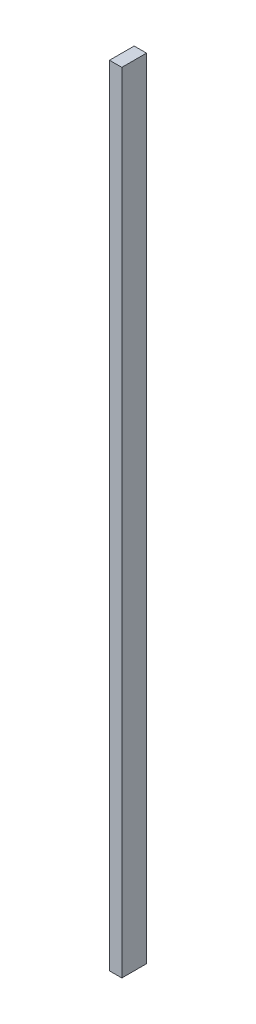
from build123d import *

# Parameters (mm, degrees)
SKETCH_1_W      = 25
SKETCH_1_H      = 50
EXTRUDE_1_DEPTH = 1600


with BuildPart() as part:
    # Эскиз1 → Бобышка-Вытянуть1 (new body)
    with BuildSketch(Plane(origin=(0, 0, 0), x_dir=(1, 0, 0), z_dir=(0, 1, 0))):
        Rectangle(SKETCH_1_W, SKETCH_1_H)
    extrude(amount=EXTRUDE_1_DEPTH)


solid = part.part
